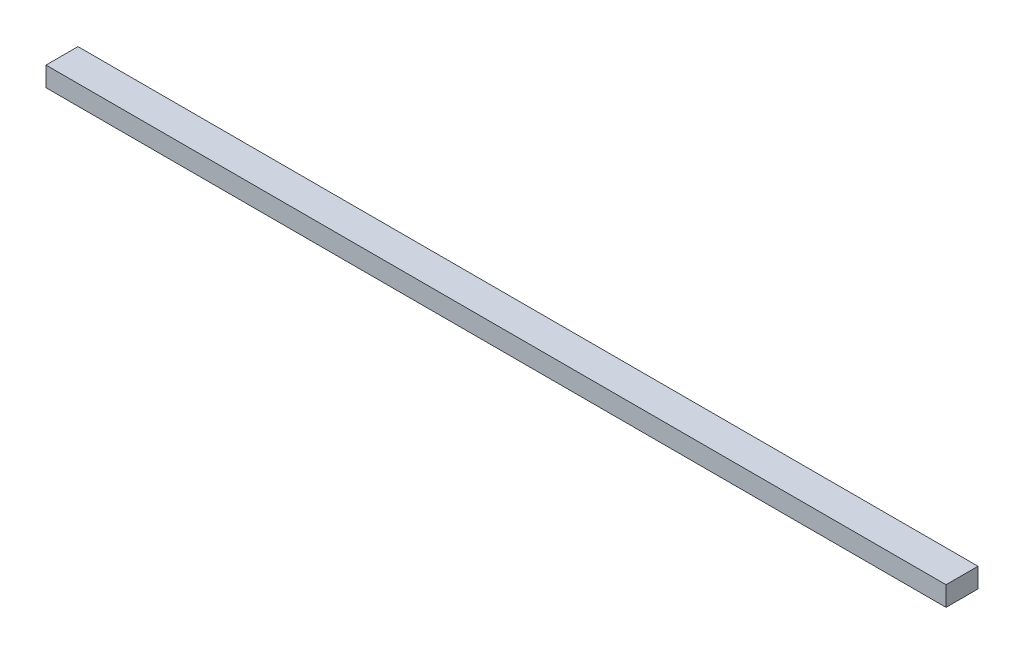
from build123d import *

# Parameters (mm, degrees)
ESBO_O1_W                = 6.5
ESBO_O1_H                = 4
RESSALTO_EXTRUS_O1_DEPTH = 183


with BuildPart() as part:
    # Esboço1 → Ressalto-extrusão1 (new body)
    with BuildSketch(Plane(origin=(0, 0, 0), x_dir=(0, 0, -1), z_dir=(1, 0, 0))):
        Rectangle(ESBO_O1_W, ESBO_O1_H)
    extrude(amount=RESSALTO_EXTRUS_O1_DEPTH)


solid = part.part
